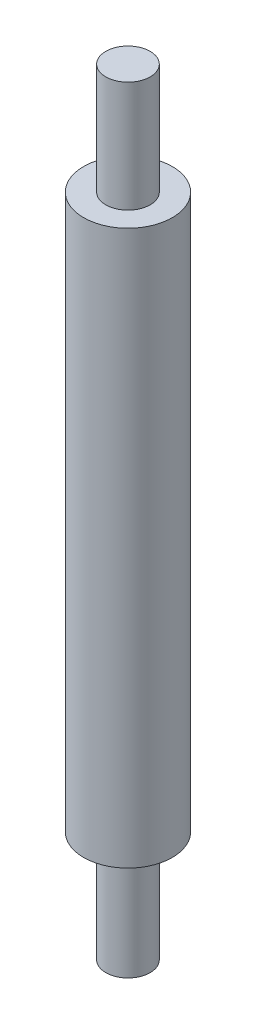
from build123d import *


with BuildPart() as part:
    # Sketch1 → Revolve1 (revolve)
    with BuildSketch(Plane.XY, mode=Mode.PRIVATE) as revolve1_sk:
        Polygon((0, 35), (2, 35), (2, 25), (4, 25), (4, -25), (2, -25), (2, -35), (0, -35), align=None)
    revolve(revolve1_sk.sketch.rotate(Axis((0, 41.486306348, 0), (0, -1, 0)), 90), axis=Axis((0, 41.486306348, 0), (0, -1, 0)))


solid = part.part
